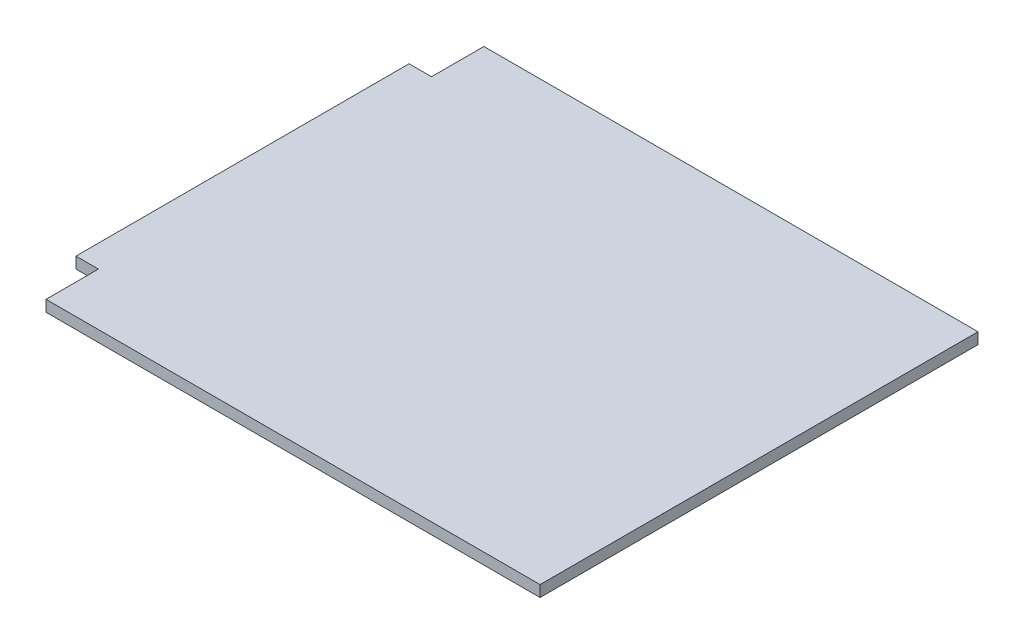
from build123d import *

# Parameters (mm, degrees)
BOSS_EXTRUDE1_DEPTH = 19.05


with BuildPart() as part:
    # Sketch1 → Boss-Extrude1 (new body)
    with BuildSketch(Plane(origin=(0, 0, 0), x_dir=(1, 0, 0), z_dir=(0, 1, 0))):
        Polygon((0, 0), (38.1, 0), (38.1, 88.9), (876.3, 88.9), (876.3, -654.05), (38.1, -654.05), (38.1, -565.15), (0, -565.15), align=None)
    extrude(amount=BOSS_EXTRUDE1_DEPTH)


solid = part.part
